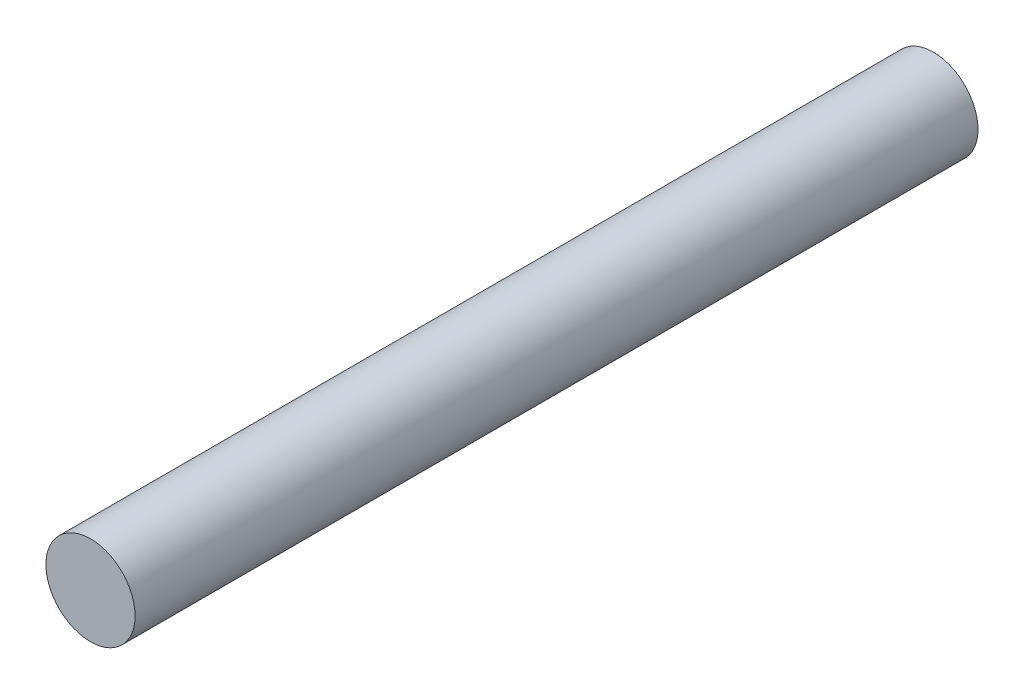
from build123d import *

# Parameters (mm, degrees)
SKETCH1_R           = 3.175
BOSS_EXTRUDE1_DEPTH = 60


with BuildPart() as part:
    # Sketch1 → Boss-Extrude1 (new body)
    with BuildSketch(Plane.XY):
        Circle(SKETCH1_R)
    extrude(amount=BOSS_EXTRUDE1_DEPTH)


solid = part.part
